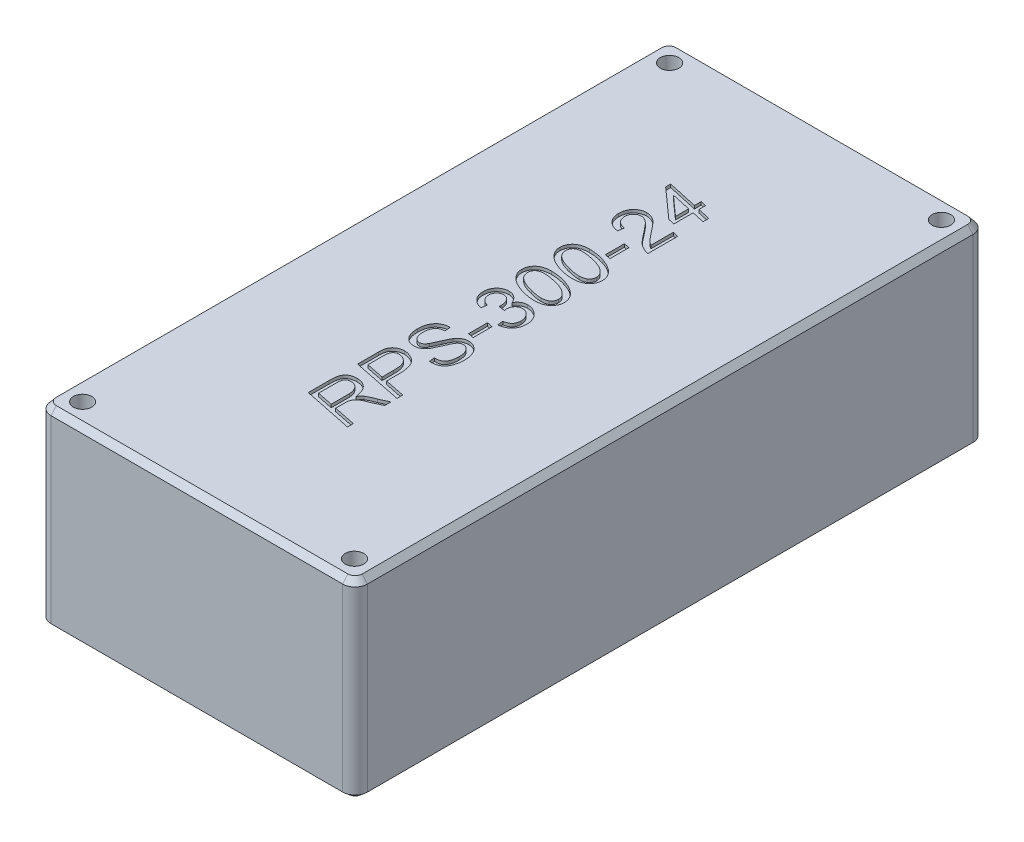
from build123d import *
from OCP.BRepFilletAPI import BRepFilletAPI_MakeChamfer

# Parameters (mm, degrees)
SKETCH_1_W          = 51.2
SKETCH_1_H          = 102
SKETCH_1_R          = 1.5
EXTRUDE_1_DEPTH     = 31
CUT_EXTRUDE_START   = 31
CUT_EXTRUDE_1_DEPTH = 0.5
FILLET_1_R          = 2
CHAMFER_1_SIZE      = 1
CHAMFER_1_SIZE2     = 0.839099631


with BuildPart() as part:
    # Эскиз1 → Бобышка-Вытянуть1 (new body)
    with BuildSketch(Plane(origin=(0, 0, 0), x_dir=(1, 0, 0), z_dir=(0, 1, 0))):
        Rectangle(SKETCH_1_W, SKETCH_1_H)
        with Locations(Location((-22, 47.5, 0), (0, 0, 270))):
            Circle(SKETCH_1_R, mode=Mode.SUBTRACT)
        with Locations(Location((22, 47.5, 0), (0, 0, 270))):
            Circle(SKETCH_1_R, mode=Mode.SUBTRACT)
        with Locations(Location((-22, -47.5, 0), (0, 0, 270))):
            Circle(SKETCH_1_R, mode=Mode.SUBTRACT)
        with Locations(Location((22, -47.5, 0), (0, 0, 270))):
            Circle(SKETCH_1_R, mode=Mode.SUBTRACT)
    extrude(amount=EXTRUDE_1_DEPTH)

    # Эскиз2 → Вырез-Вытянуть1 (cut)
    # profile 1 of 10: a face of its own
    with BuildSketch(Plane(origin=(9.711469616, 0, 7.490347416), x_dir=(0, 0, -1), z_dir=(0, 1, 0)).offset(CUT_EXTRUDE_START)):
        with BuildLine():
            Line((-22.096144557, 6.742030716), (-20.455118916, 14.742030716))
            Line((-20.455118916, 14.742030716), (-17.104157378, 14.742030716))
            add(Edge.make_bspline(
                [(-17.104157378, 14.742030716), (-17.024033136, 14.741073401), (-16.8691024, 14.739222306), (-16.643973201, 14.734723594), (-16.434170274, 14.718450691), (-16.238266442, 14.702744319), (-16.057924121, 14.677350469), (-15.891466065, 14.652249895), (-15.741720929, 14.615760069), (-15.562702299, 14.566475878), (-15.358413224, 14.482037587), (-15.139839717, 14.341781631), (-14.95062384, 14.162511994), (-14.790123435, 13.949934393), (-14.660707837, 13.704058611), (-14.570178113, 13.426196087), (-14.515028265, 13.118682325), (-14.509353241, 12.903600539), (-14.506400967, 12.791710204)],
                knots=[0, 0, 0, 0, 1.021591991, 1.975382171, 2.869596121, 3.703787351, 4.480068521, 5.190988995, 5.848428166, 6.443359442, 7.557581638, 8.651303689, 9.735293539, 10.863044018, 12.032780594, 13.26028335, 14.57473838, 16, 16, 16, 16], degree=3))
            add(Edge.make_bspline(
                [(-14.506400967, 12.791710204), (-14.508180182, 12.712026912), (-14.511679045, 12.555328007), (-14.541305785, 12.325219027), (-14.58904692, 12.10522419), (-14.655890127, 11.895252361), (-14.745670923, 11.697636327), (-14.851153581, 11.508146972), (-14.978788924, 11.33094156), (-15.123227701, 11.162087192), (-15.291076304, 11.007841797), (-15.482498159, 10.867393864), (-15.697197209, 10.741091553), (-15.936740333, 10.631028005), (-16.198514416, 10.533032609), (-16.484272, 10.450783911), (-16.79349987, 10.380995087), (-17.008822116, 10.348552859), (-17.120183019, 10.331774306)],
                knots=[0, 0, 0, 0, 0.959383756, 1.886648769, 2.788937229, 3.667871959, 4.534714923, 5.398951626, 6.275481347, 7.16032984, 8.0709063, 9.014104106, 10.014875828, 11.065445977, 12.185151704, 13.378199168, 14.644050423, 16, 16, 16, 16], degree=3))
            add(Edge.make_bspline(
                [(-17.120183019, 10.331774306), (-17.050599575, 10.282451577), (-16.917552051, 10.188143697), (-16.737148124, 10.038726444), (-16.583144584, 9.890183463), (-16.496466684, 9.78553885), (-16.455118916, 9.73562046)],
                knots=[0, 0, 0, 0, 1.141328929, 2.182286196, 3.13289998, 4, 4, 4, 4], degree=3))
            add(Edge.make_bspline(
                [(-16.455118916, 9.73562046), (-16.385358584, 9.61403593), (-16.246266976, 9.371614665), (-16.063310687, 8.996544241), (-15.900033506, 8.615704354), (-15.807440706, 8.356853274), (-15.76120866, 8.227607639)],
                knots=[0, 0, 0, 0, 1.01134494, 2.016469698, 3.009613427, 4, 4, 4, 4], degree=3))
            Line((-15.76120866, 8.227607639), (-15.078516352, 6.742030716))
            Line((-15.078516352, 6.742030716), (-16.084926608, 6.742030716))
            Line((-16.084926608, 6.742030716), (-16.786849685, 8.266069178))
            add(Edge.make_bspline(
                [(-16.786849685, 8.266069178), (-16.835232802, 8.399589386), (-16.929530609, 8.65981782), (-17.088789186, 9.031345439), (-17.255464082, 9.376685689), (-17.381079243, 9.591073442), (-17.442298403, 9.695556357)],
                knots=[0, 0, 0, 0, 1.081563103, 2.107946641, 3.077898582, 4, 4, 4, 4], degree=3))
            add(Edge.make_bspline(
                [(-17.442298403, 9.695556357), (-17.499115738, 9.754138971), (-17.606853512, 9.865224088), (-17.773518376, 10.009565956), (-17.935947673, 10.121264973), (-18.071460572, 10.192803867), (-18.184008514, 10.235062014), (-18.278769085, 10.25959357), (-18.384657628, 10.28195164), (-18.502209031, 10.301425744), (-18.631686778, 10.31547029), (-18.773398803, 10.324421011), (-18.926738243, 10.331413455), (-19.033101289, 10.331651266), (-19.088131737, 10.331774306)],
                knots=[0, 0, 0, 0, 1.598120377, 3.030376753, 4.310245873, 5.452094104, 6.021554155, 6.661189251, 7.36713587, 8.141211616, 8.993958559, 9.916871072, 10.9222242, 12, 12, 12, 12], degree=3))
            Line((-19.088131737, 10.331774306), (-20.42146507, 10.331774306))
            Line((-20.42146507, 10.331774306), (-21.157041993, 6.742030716))
            Line((-21.157041993, 6.742030716), (-22.096144557, 6.742030716))
        make_face()
        with BuildLine():
            Line((-20.232362506, 11.254851229), (-18.665054813, 11.254851229))
            add(Edge.make_bspline(
                [(-18.665054813, 11.254851229), (-18.578516352, 11.254851229), (-18.412918061, 11.254851229), (-18.176272762, 11.254851229), (-17.963131737, 11.254851229), (-17.774029172, 11.254851229), (-17.60896507, 11.254851229), (-17.467405241, 11.254851229), (-17.349349685, 11.254851229), (-17.278302677, 11.254851229), (-17.246785583, 11.254851229)],
                knots=[0, 0, 0, 0, 1.46440678, 2.802259887, 4.004519774, 5.071186441, 6.002259887, 6.797740113, 7.466666667, 8, 8, 8, 8], degree=3))
            add(Edge.make_bspline(
                [(-17.246785583, 11.254851229), (-17.149859175, 11.266115717), (-16.963392168, 11.287786338), (-16.698964682, 11.343812277), (-16.460847067, 11.416301536), (-16.25039301, 11.51028627), (-16.063151444, 11.620972934), (-15.900813024, 11.752559947), (-15.757348072, 11.898254451), (-15.64109195, 12.063452646), (-15.546022212, 12.238417762), (-15.478288682, 12.422975846), (-15.436338145, 12.614068067), (-15.43177493, 12.743955455), (-15.42947789, 12.809338409)],
                knots=[0, 0, 0, 0, 1.325929785, 2.550823495, 3.669386314, 4.703146632, 5.677069501, 6.617269372, 7.536567314, 8.447451244, 9.353924369, 10.236192207, 11.112131162, 12, 12, 12, 12], degree=3))
            add(Edge.make_bspline(
                [(-15.42947789, 12.809338409), (-15.430946263, 12.863476479), (-15.43382357, 12.969561145), (-15.467406122, 13.122117865), (-15.518477537, 13.26490783), (-15.592431821, 13.393489658), (-15.681956013, 13.507500022), (-15.785316289, 13.604475184), (-15.904197816, 13.677836421), (-16.01304244, 13.725055542), (-16.110654068, 13.751277292), (-16.195842979, 13.771602517), (-16.293676834, 13.784201661), (-16.403044368, 13.798018918), (-16.524513765, 13.806375773), (-16.65744654, 13.815598936), (-16.802341133, 13.817485293), (-16.902771696, 13.818450632), (-16.955118916, 13.818953793)],
                knots=[0, 0, 0, 0, 1.231552236, 2.413252045, 3.541589205, 4.675427927, 5.776114033, 6.835648598, 7.885913462, 8.943978734, 9.52582679, 10.1872786, 10.937816351, 11.771229383, 12.699189452, 13.711307509, 14.807069424, 16, 16, 16, 16], degree=3))
            Line((-16.955118916, 13.818953793), (-19.70672148, 13.818953793))
            Line((-19.70672148, 13.818953793), (-20.232362506, 11.254851229))
        make_face(mode=Mode.SUBTRACT)
    # profile 2 of 10: a face of its own
    with BuildSketch(Plane(origin=(9.711469616, 0, 7.490347416), x_dir=(0, 0, -1), z_dir=(0, 1, 0)).offset(CUT_EXTRUDE_START)):
        with BuildLine():
            Line((-14.096144557, 6.742030716), (-12.469541993, 14.742030716))
            Line((-12.469541993, 14.742030716), (-9.121785583, 14.742030716))
            add(Edge.make_bspline(
                [(-9.121785583, 14.742030716), (-9.051789517, 14.741516156), (-8.916001475, 14.740517942), (-8.719403792, 14.730004732), (-8.535771716, 14.717246072), (-8.3660357, 14.693514104), (-8.208734375, 14.668171524), (-8.066245356, 14.632033005), (-7.93676899, 14.59269687), (-7.783054236, 14.530640948), (-7.605047859, 14.433252429), (-7.415143369, 14.277433017), (-7.241064884, 14.090001667), (-7.093680308, 13.86731048), (-6.968292356, 13.623013422), (-6.877817028, 13.358788952), (-6.823959118, 13.079698177), (-6.817413718, 12.888635295), (-6.814093275, 12.791710204)],
                knots=[0, 0, 0, 0, 0.972213442, 1.886034001, 2.73461593, 3.528031695, 4.266112178, 4.946424875, 5.568385486, 6.144379862, 7.247133722, 8.371276825, 9.542347188, 10.7875294, 12.068525623, 13.34747836, 14.654391165, 16, 16, 16, 16], degree=3))
            add(Edge.make_bspline(
                [(-6.814093275, 12.791710204), (-6.816661065, 12.709311711), (-6.821857053, 12.542576317), (-6.861603627, 12.291630333), (-6.928438606, 12.039481445), (-7.01746765, 11.789421701), (-7.124212132, 11.548792848), (-7.248022793, 11.327042705), (-7.383863682, 11.126187175), (-7.535468106, 10.950993327), (-7.692159269, 10.795923044), (-7.850845625, 10.660249123), (-8.011666201, 10.546226179), (-8.173585512, 10.450282359), (-8.339304768, 10.371215884), (-8.509508354, 10.304752684), (-8.684266954, 10.245131489), (-8.804723453, 10.217488093), (-8.865375326, 10.203569178)],
                knots=[0, 0, 0, 0, 1.108226401, 2.242523613, 3.408656374, 4.613347543, 5.810038033, 6.945723126, 8.026127651, 9.0659746, 10.056915813, 10.989982556, 11.871357951, 12.705775869, 13.519003935, 14.338400696, 15.163356799, 16, 16, 16, 16], degree=3))
            add(Edge.make_bspline(
                [(-8.865375326, 10.203569178), (-8.995963318, 10.175796716), (-9.256938325, 10.120294533), (-9.653169322, 10.065803738), (-10.051158619, 10.030475039), (-10.317222804, 10.026213613), (-10.450311224, 10.024081998)],
                knots=[0, 0, 0, 0, 1.002108218, 2.002674186, 3.000914255, 4, 4, 4, 4], degree=3))
            Line((-10.450311224, 10.024081998), (-12.490375326, 10.024081998))
            Line((-12.490375326, 10.024081998), (-13.157041993, 6.742030716))
            Line((-13.157041993, 6.742030716), (-14.096144557, 6.742030716))
        make_face()
        with BuildLine():
            Line((-12.301272762, 10.947158921), (-10.432683019, 10.947158921))
            add(Edge.make_bspline(
                [(-10.432683019, 10.947158921), (-10.345056974, 10.947518904), (-10.175602811, 10.948215049), (-9.930939532, 10.960711004), (-9.70359559, 10.975270821), (-9.495142434, 10.999488842), (-9.303926762, 11.029122203), (-9.132004128, 11.068058774), (-8.976460607, 11.109870736), (-8.796835227, 11.178527164), (-8.59353215, 11.279615272), (-8.377333049, 11.431856626), (-8.186849746, 11.609645507), (-8.028143677, 11.813606975), (-7.897843356, 12.032217393), (-7.806449396, 12.262869595), (-7.746352377, 12.499112259), (-7.740232731, 12.659942039), (-7.737170198, 12.740428152)],
                knots=[0, 0, 0, 0, 1.151155803, 2.226143411, 3.21826883, 4.143729154, 4.982605772, 5.759118673, 6.459057944, 7.096526282, 8.283022298, 9.431864906, 10.558998043, 11.693536865, 12.816641856, 13.890597882, 14.944364791, 16, 16, 16, 16], degree=3))
            add(Edge.make_bspline(
                [(-7.737170198, 12.740428152), (-7.738483945, 12.800451365), (-7.741003686, 12.915574672), (-7.774886168, 13.079216799), (-7.824176846, 13.227029136), (-7.899103602, 13.355541081), (-7.988508753, 13.469391112), (-8.098724576, 13.564883283), (-8.224475279, 13.645321272), (-8.343699425, 13.699133116), (-8.452809883, 13.735341051), (-8.553904989, 13.756941096), (-8.671627482, 13.775646959), (-8.806903977, 13.791531949), (-8.958714271, 13.803888437), (-9.128074516, 13.813910164), (-9.314607239, 13.817971221), (-9.444968789, 13.818617473), (-9.512811224, 13.818953793)],
                knots=[0, 0, 0, 0, 1.201897544, 2.305215139, 3.33889324, 4.31315314, 5.273763113, 6.230420188, 7.223243535, 8.259085597, 8.845332397, 9.526443264, 10.329775667, 11.236264155, 12.257874257, 13.384875313, 14.639043291, 16, 16, 16, 16], degree=3))
            Line((-9.512811224, 13.818953793), (-11.717939429, 13.818953793))
            Line((-11.717939429, 13.818953793), (-12.301272762, 10.947158921))
        make_face(mode=Mode.SUBTRACT)
    # profile 3 of 10: a face of its own
    with BuildSketch(Plane(origin=(9.711469616, 0, 7.490347416), x_dir=(0, 0, -1), z_dir=(0, 1, 0)).offset(CUT_EXTRUDE_START)):
        with BuildLine():
            Line((-6.301272762, 9.30613328), (-5.378195839, 9.408697383))
            Line((-5.378195839, 9.408697383), (-5.389413788, 9.142671742))
            add(Edge.make_bspline(
                [(-5.389413788, 9.142671742), (-5.386565543, 9.070362317), (-5.380926421, 8.927199899), (-5.338293969, 8.717792005), (-5.268034155, 8.518176886), (-5.172937766, 8.3277768), (-5.043509226, 8.15141773), (-4.874102042, 7.998077315), (-4.6703232, 7.864610096), (-4.431434533, 7.755709615), (-4.164305228, 7.668164801), (-3.870906337, 7.606531544), (-3.55381704, 7.569695089), (-3.334495414, 7.564980271), (-3.221144557, 7.562543537)],
                knots=[0, 0, 0, 0, 0.858275681, 1.699264264, 2.525822281, 3.365565876, 4.218149606, 5.107011874, 6.064126396, 7.09998594, 8.215326971, 9.396056326, 10.654217318, 12, 12, 12, 12], degree=3))
            add(Edge.make_bspline(
                [(-3.221144557, 7.562543537), (-3.140441488, 7.563696987), (-2.983601666, 7.565938623), (-2.755577045, 7.585453193), (-2.542379345, 7.61684374), (-2.343994915, 7.661468083), (-2.160935686, 7.719512419), (-1.991047042, 7.787668765), (-1.836694647, 7.870956021), (-1.698891794, 7.967914537), (-1.576443678, 8.071786105), (-1.467443898, 8.178620958), (-1.378150004, 8.291558566), (-1.302562041, 8.406155218), (-1.244461128, 8.525759392), (-1.202615698, 8.648950103), (-1.177562545, 8.776275166), (-1.174576629, 8.862112542), (-1.173067634, 8.905492255)],
                knots=[0, 0, 0, 0, 1.425731279, 2.770792289, 4.04024254, 5.230893421, 6.3592722, 7.430212247, 8.460708778, 9.450459374, 10.401561135, 11.295891975, 12.14200498, 12.940503131, 13.717227411, 14.484314755, 15.234016756, 16, 16, 16, 16], degree=3))
            add(Edge.make_bspline(
                [(-1.173067634, 8.905492255), (-1.176419479, 8.965737371), (-1.18306914, 9.085256522), (-1.238291653, 9.258868601), (-1.323211923, 9.42579406), (-1.404929113, 9.523389306), (-1.447106096, 9.573761486)],
                knots=[0, 0, 0, 0, 0.976847459, 1.937949255, 2.935706458, 4, 4, 4, 4], degree=3))
            add(Edge.make_bspline(
                [(-1.447106096, 9.573761486), (-1.4748971, 9.600543695), (-1.53734007, 9.660720029), (-1.654471653, 9.745626494), (-1.800786231, 9.838268444), (-1.977667762, 9.937085704), (-2.184366042, 10.042131931), (-2.42126638, 10.15449775), (-2.687885005, 10.274183915), (-2.876961965, 10.354058786), (-2.975952249, 10.39587687)],
                knots=[0, 0, 0, 0, 0.53058602, 1.192161577, 1.98540538, 2.9135926, 3.978754358, 5.17558752, 6.521293165, 8, 8, 8, 8], degree=3))
            add(Edge.make_bspline(
                [(-2.975952249, 10.39587687), (-3.053531435, 10.42817928), (-3.202667221, 10.490276418), (-3.415651489, 10.584292535), (-3.611127512, 10.669119664), (-3.785234742, 10.75220028), (-3.941762639, 10.824791184), (-4.077470881, 10.894248556), (-4.195382526, 10.955745427), (-4.265659369, 10.998127288), (-4.298067634, 11.017671742)],
                knots=[0, 0, 0, 0, 1.379339666, 2.651599208, 3.821445283, 4.876640935, 5.817965058, 6.653218182, 7.378929685, 8, 8, 8, 8], degree=3))
            add(Edge.make_bspline(
                [(-4.298067634, 11.017671742), (-4.386091349, 11.075520848), (-4.555266704, 11.18670274), (-4.775891714, 11.379020907), (-4.96762786, 11.571317248), (-5.118495368, 11.778385907), (-5.236304037, 11.995259075), (-5.318371292, 12.226648069), (-5.369925192, 12.472119146), (-5.375403287, 12.641342943), (-5.378195839, 12.727607639)],
                knots=[0, 0, 0, 0, 1.190296613, 2.28766591, 3.304920813, 4.256269293, 5.175634749, 6.087520294, 7.025081087, 8, 8, 8, 8], degree=3))
            add(Edge.make_bspline(
                [(-5.378195839, 12.727607639), (-5.374193865, 12.827280368), (-5.366306263, 13.023728131), (-5.30349416, 13.310834641), (-5.200173776, 13.582397438), (-5.080442866, 13.794144615), (-4.966484646, 13.953158574), (-4.870075416, 14.065905807), (-4.762738323, 14.170086134), (-4.648718375, 14.270190964), (-4.522194653, 14.358933569), (-4.389025331, 14.443910582), (-4.244371006, 14.517810376), (-4.039782738, 14.611184131), (-3.765629335, 14.705405089), (-3.418390968, 14.787185909), (-3.050515433, 14.835866763), (-2.798749193, 14.841639554), (-2.669862506, 14.844594819)],
                knots=[0, 0, 0, 0, 1.238475896, 2.440946701, 3.635078099, 4.839601842, 5.453463916, 6.065850834, 6.681148677, 7.312269075, 7.950065238, 8.600634686, 9.275045789, 9.967691431, 11.396165333, 12.870345012, 14.397835766, 16, 16, 16, 16], degree=3))
            add(Edge.make_bspline(
                [(-2.669862506, 14.844594819), (-2.592370481, 14.84388717), (-2.440949867, 14.842504413), (-2.218539558, 14.825371663), (-2.004934959, 14.800672297), (-1.800648246, 14.763616571), (-1.605067513, 14.717466496), (-1.419552142, 14.659457978), (-1.242319474, 14.592788563), (-1.075945162, 14.513585885), (-0.919199224, 14.427344818), (-0.772391655, 14.334568297), (-0.637805665, 14.233297619), (-0.513975385, 14.125779044), (-0.400786367, 14.011677526), (-0.30001642, 13.889540357), (-0.209659409, 13.761096637), (-0.107224672, 13.583366811), (-0.00270574, 13.359429058), (0.089869674, 13.091021553), (0.150258754, 12.828590424), (0.156980451, 12.65419168), (0.160265699, 12.568953793)],
                knots=[0, 0, 0, 0, 1.143512507, 2.234441106, 3.290654609, 4.316047515, 5.297102877, 6.254749841, 7.183126598, 8.089581974, 8.971812638, 9.822656227, 10.650539834, 11.455310542, 12.241441721, 13.019784509, 13.789735541, 14.55649065, 16.045011508, 17.428866519, 18.743351145, 20, 20, 20, 20], degree=3))
            add(Edge.make_bspline(
                [(0.160265699, 12.568953793), (0.160265699, 12.546517896), (0.160265699, 12.49096234), (0.160265699, 12.435406785), (0.160265699, 12.402287127)],
                knots=[0, 0, 0, 0, 0.807692308, 2, 2, 2, 2], degree=3))
            Line((0.160265699, 12.402287127), (-0.762811224, 12.318953793))
            add(Edge.make_bspline(
                [(-0.762811224, 12.318953793), (-0.763206778, 12.372401882), (-0.763955392, 12.473556134), (-0.775218358, 12.615909635), (-0.792659107, 12.740206492), (-0.813882544, 12.814845724), (-0.82370866, 12.849402511)],
                knots=[0, 0, 0, 0, 1.196373472, 2.264220624, 3.196361544, 4, 4, 4, 4], degree=3))
            add(Edge.make_bspline(
                [(-0.82370866, 12.849402511), (-0.843237021, 12.903374439), (-0.881729628, 13.009759209), (-0.961134921, 13.157526565), (-1.05551191, 13.291781975), (-1.163160111, 13.416045082), (-1.292704861, 13.52546905), (-1.440704912, 13.62594827), (-1.612626998, 13.711718194), (-1.803595302, 13.786068192), (-2.01146207, 13.847219476), (-2.233205115, 13.889072146), (-2.466636929, 13.918159109), (-2.626498684, 13.920380748), (-2.708324044, 13.921517896)],
                knots=[0, 0, 0, 0, 0.88689608, 1.748172411, 2.584840347, 3.421997753, 4.283274084, 5.199961756, 6.182923366, 7.247800225, 8.366915099, 9.5288022, 10.735115532, 12, 12, 12, 12], degree=3))
            add(Edge.make_bspline(
                [(-2.708324044, 13.921517896), (-2.779936991, 13.92019676), (-2.919113511, 13.917629193), (-3.121611197, 13.900402401), (-3.311604784, 13.869649223), (-3.489569865, 13.82846687), (-3.656095798, 13.775722595), (-3.810295382, 13.710128527), (-3.952417796, 13.631993734), (-4.037993317, 13.569344787), (-4.080118916, 13.538505075)],
                knots=[0, 0, 0, 0, 1.185078943, 2.303147281, 3.3596952, 4.367486573, 5.323590023, 6.246379327, 7.136758724, 8, 8, 8, 8], degree=3))
            add(Edge.make_bspline(
                [(-4.080118916, 13.538505075), (-4.11022356, 13.514167159), (-4.169187729, 13.466497934), (-4.244326295, 13.382617473), (-4.311626244, 13.295746057), (-4.361684727, 13.199203929), (-4.405108055, 13.099755542), (-4.433089348, 12.992700006), (-4.451267698, 12.880472752), (-4.453821868, 12.803536213), (-4.455118916, 12.764466614)],
                knots=[0, 0, 0, 0, 1.039030166, 2.035086348, 3.020315512, 3.984274806, 4.949837582, 5.932341348, 6.950010026, 8, 8, 8, 8], degree=3))
            add(Edge.make_bspline(
                [(-4.455118916, 12.764466614), (-4.453370211, 12.717832149), (-4.449938057, 12.626303473), (-4.419781231, 12.492838536), (-4.371556649, 12.366891661), (-4.302728885, 12.246270123), (-4.205891996, 12.131355667), (-4.079301938, 12.020079985), (-3.922763426, 11.909288529), (-3.804635549, 11.84293254), (-3.74197789, 11.807735845)],
                knots=[0, 0, 0, 0, 0.885166844, 1.737301987, 2.585559362, 3.440410528, 4.36313212, 5.426921844, 6.635181999, 8, 8, 8, 8], degree=3))
            add(Edge.make_bspline(
                [(-3.74197789, 11.807735845), (-3.71367185, 11.793302672), (-3.649186178, 11.760421603), (-3.540904463, 11.705551509), (-3.406460424, 11.643837109), (-3.248764796, 11.569086898), (-3.06413154, 11.489396989), (-2.857681095, 11.394485903), (-2.62430312, 11.294727586), (-2.460945024, 11.223446842), (-2.374990711, 11.185940973)],
                knots=[0, 0, 0, 0, 0.507694923, 1.156609942, 1.939357829, 2.871124938, 3.94489054, 5.152129338, 6.501532703, 8, 8, 8, 8], degree=3))
            add(Edge.make_bspline(
                [(-2.374990711, 11.185940973), (-2.305011851, 11.154959061), (-2.170311214, 11.095322719), (-1.976390083, 11.009450019), (-1.800031258, 10.92781391), (-1.640983377, 10.85055493), (-1.498513214, 10.779096758), (-1.373105163, 10.711459102), (-1.264487301, 10.649683182), (-1.198596814, 10.608670103), (-1.168259942, 10.589787127)],
                knots=[0, 0, 0, 0, 1.363402043, 2.62438005, 3.778247165, 4.825290736, 5.77437896, 6.617445503, 7.363453188, 8, 8, 8, 8], degree=3))
            add(Edge.make_bspline(
                [(-1.168259942, 10.589787127), (-1.097540067, 10.541221014), (-0.95879514, 10.445939428), (-0.775839269, 10.27731007), (-0.616645415, 10.09532227), (-0.484526169, 9.89714932), (-0.379570688, 9.684487156), (-0.303548544, 9.457776743), (-0.257453593, 9.216657897), (-0.252513667, 9.050997165), (-0.249990711, 8.966389691)],
                knots=[0, 0, 0, 0, 1.054714124, 2.069237773, 3.052629045, 4.024524991, 4.991873927, 5.962790947, 6.959541516, 8, 8, 8, 8], degree=3))
            add(Edge.make_bspline(
                [(-0.249990711, 8.966389691), (-0.251332204, 8.9129272), (-0.25398224, 8.807315409), (-0.271862689, 8.650190502), (-0.302596372, 8.497127692), (-0.343791098, 8.345958626), (-0.4012093, 8.199649048), (-0.466214534, 8.054201735), (-0.545371117, 7.912878035), (-0.636422085, 7.776152081), (-0.737493001, 7.64384413), (-0.849606717, 7.519670463), (-0.9700507, 7.402441899), (-1.098908875, 7.292270976), (-1.238612448, 7.19157295), (-1.388174824, 7.09921273), (-1.545371783, 7.011864106), (-1.769087532, 6.906980616), (-2.068067741, 6.797934378), (-2.449593986, 6.705336298), (-2.856312064, 6.650607567), (-3.13550456, 6.643245939), (-3.278836865, 6.639466614)],
                knots=[0, 0, 0, 0, 0.753323331, 1.488142895, 2.22477222, 2.951645461, 3.692569589, 4.437003057, 5.195162042, 5.9717794, 6.750145735, 7.539032231, 8.32684067, 9.11716229, 9.925698599, 10.750710093, 11.592951182, 12.45831893, 14.230046657, 16.066640586, 17.980685438, 20, 20, 20, 20], degree=3))
            add(Edge.make_bspline(
                [(-3.278836865, 6.639466614), (-3.387341329, 6.641318628), (-3.599359417, 6.644937469), (-3.909733337, 6.673021827), (-4.20561433, 6.716591305), (-4.485756447, 6.781735592), (-4.752238007, 6.859937491), (-5.000838405, 6.9628378), (-5.236174368, 7.079025857), (-5.455727654, 7.214653772), (-5.655054057, 7.375121913), (-5.828989634, 7.565428679), (-5.975521776, 7.785494259), (-6.093618459, 8.034871502), (-6.186849871, 8.311890376), (-6.253189333, 8.617628752), (-6.293011143, 8.952524976), (-6.298449478, 9.185292937), (-6.301272762, 9.30613328)],
                knots=[0, 0, 0, 0, 1.125067994, 2.198386657, 3.229442192, 4.223907366, 5.179018808, 6.105903256, 7.010179201, 7.898637484, 8.776811776, 9.655143314, 10.561656395, 11.508166035, 12.508477435, 13.586446658, 14.74701564, 16, 16, 16, 16], degree=3))
        make_face()
    # profile 4 of 10: a face of its own
    with BuildSketch(Plane(origin=(9.711469616, 0, 7.490347416), x_dir=(0, 0, -1), z_dir=(0, 1, 0)).offset(CUT_EXTRUDE_START)):
        Polygon((0.57052211, 9.101005075), (0.775650315, 10.024081998), (3.852573392, 10.024081998), (3.647445187, 9.101005075), align=None)
    # profile 5 of 10: a face of its own
    with BuildSketch(Plane(origin=(9.711469616, 0, 7.490347416), x_dir=(0, 0, -1), z_dir=(0, 1, 0)).offset(CUT_EXTRUDE_START)):
        with BuildLine():
            Line((4.365393904, 8.89587687), (5.288470828, 8.998440973))
            add(Edge.make_bspline(
                [(5.288470828, 8.998440973), (5.298222412, 8.9362922), (5.317096145, 8.816006177), (5.359809878, 8.643940304), (5.408589457, 8.484384285), (5.467906066, 8.338690852), (5.534888542, 8.206381568), (5.610958539, 8.088548987), (5.693835019, 7.982929036), (5.788363628, 7.892893515), (5.889525936, 7.814329528), (5.997996284, 7.745590931), (6.115403165, 7.690476707), (6.239188001, 7.64389404), (6.370267541, 7.606061363), (6.509459244, 7.581811773), (6.656098274, 7.564613697), (6.756365589, 7.563244536), (6.807701597, 7.562543537)],
                knots=[0, 0, 0, 0, 1.294426065, 2.505300711, 3.646088348, 4.726332612, 5.739452866, 6.694195637, 7.609559141, 8.49613314, 9.373796622, 10.243362574, 11.133611648, 12.038411762, 12.964348743, 13.937097054, 14.943811342, 16, 16, 16, 16], degree=3))
            add(Edge.make_bspline(
                [(6.807701597, 7.562543537), (6.869723395, 7.564226033), (6.992568434, 7.567558511), (7.173535737, 7.589723891), (7.348031453, 7.629212702), (7.516565179, 7.681026459), (7.677540018, 7.751119893), (7.832744862, 7.834919343), (7.98134726, 7.934164534), (8.121731556, 8.047507815), (8.249371491, 8.170757737), (8.363109143, 8.299159223), (8.457894141, 8.433361906), (8.537908277, 8.570898126), (8.596720015, 8.714858516), (8.640325331, 8.861862231), (8.669432669, 9.013321573), (8.671861624, 9.116363083), (8.673086212, 9.168312768)],
                knots=[0, 0, 0, 0, 1.094666222, 2.168178271, 3.211243268, 4.24892566, 5.275195374, 6.304535234, 7.358325136, 8.424359069, 9.484540223, 10.486752883, 11.446838671, 12.380022527, 13.288739249, 14.183656868, 15.084267561, 16, 16, 16, 16], degree=3))
            add(Edge.make_bspline(
                [(8.673086212, 9.168312768), (8.671709423, 9.213225987), (8.669010566, 9.30126729), (8.652087948, 9.430575121), (8.618854011, 9.553126223), (8.575803652, 9.67022371), (8.521530034, 9.782443274), (8.451559183, 9.886220727), (8.37075034, 9.9852002), (8.278004511, 10.076985139), (8.176543323, 10.162981404), (8.06295761, 10.23364686), (7.944221859, 10.298320574), (7.81427689, 10.346708491), (7.677479917, 10.387610499), (7.531198486, 10.413607997), (7.377650961, 10.432670923), (7.271975986, 10.433774362), (7.217958007, 10.434338409)],
                knots=[0, 0, 0, 0, 0.995499634, 1.951431809, 2.881733097, 3.803104256, 4.713689825, 5.636276914, 6.569961265, 7.540947269, 8.524622692, 9.509721668, 10.499928494, 11.515565199, 12.575756501, 13.659995629, 14.803857697, 16, 16, 16, 16], degree=3))
            add(Edge.make_bspline(
                [(7.217958007, 10.434338409), (7.201839861, 10.432665632), (7.162459206, 10.428578623), (7.094399147, 10.406214155), (7.005429486, 10.375041592), (6.94002071, 10.347179551), (6.903855443, 10.331774306)],
                knots=[0, 0, 0, 0, 0.584983048, 1.429259602, 2.578607939, 4, 4, 4, 4], degree=3))
            Line((6.903855443, 10.331774306), (7.072124674, 11.376646101))
            add(Edge.make_bspline(
                [(7.072124674, 11.376646101), (7.118008549, 11.37103779), (7.20796394, 11.360042691), (7.298568464, 11.358279276), (7.342958007, 11.357415332)],
                knots=[0, 0, 0, 0, 1.020147305, 2, 2, 2, 2], degree=3))
            add(Edge.make_bspline(
                [(7.342958007, 11.357415332), (7.410839357, 11.358686691), (7.542565571, 11.36115381), (7.734242754, 11.379030053), (7.914146447, 11.407756366), (8.082474755, 11.446519668), (8.237691405, 11.500343618), (8.381069801, 11.564377287), (8.513056648, 11.639451416), (8.632086615, 11.726368819), (8.737196309, 11.822179768), (8.82913841, 11.923895421), (8.908866768, 12.029875174), (8.972927137, 12.141841744), (9.022084194, 12.259890146), (9.056203321, 12.382686235), (9.080796783, 12.510829802), (9.082484142, 12.59821341), (9.083342622, 12.642671742)],
                knots=[0, 0, 0, 0, 1.344989644, 2.610001018, 3.810758888, 4.953276435, 6.027819718, 7.060679099, 8.061136458, 9.030825869, 9.974989578, 10.874297366, 11.744412807, 12.59782058, 13.423467791, 14.271145057, 15.120407015, 16, 16, 16, 16], degree=3))
            add(Edge.make_bspline(
                [(9.083342622, 12.642671742), (9.081797483, 12.683293539), (9.078756407, 12.763243601), (9.064038446, 12.881503191), (9.031706662, 12.993446036), (8.99329209, 13.102083624), (8.937939784, 13.202997656), (8.877108452, 13.30266591), (8.7977284, 13.392656767), (8.712884235, 13.481430426), (8.617364116, 13.559575382), (8.517223096, 13.630814555), (8.409562372, 13.686818132), (8.298346608, 13.736656893), (8.181238071, 13.772240868), (8.059374598, 13.800648154), (7.932056057, 13.816475854), (7.845134677, 13.81812298), (7.80129134, 13.818953793)],
                knots=[0, 0, 0, 0, 1.006415868, 1.980784109, 2.939958003, 3.885636602, 4.8261232, 5.783563509, 6.768996359, 7.788275121, 8.82110339, 9.818881085, 10.82468861, 11.81965813, 12.831791823, 13.848751795, 14.91490564, 16, 16, 16, 16], degree=3))
            add(Edge.make_bspline(
                [(7.80129134, 13.818953793), (7.715439716, 13.814465469), (7.545573259, 13.805584847), (7.297780646, 13.73965977), (7.065082122, 13.627464209), (6.88524583, 13.501498337), (6.751998884, 13.382141202), (6.661510055, 13.28108892), (6.579316362, 13.172132876), (6.507410102, 13.053201297), (6.444859728, 12.925334691), (6.389606022, 12.78925768), (6.347178086, 12.642822962), (6.325268642, 12.541847275), (6.314111853, 12.490428152)],
                knots=[0, 0, 0, 0, 1.422179699, 2.813931943, 4.216039858, 5.685001299, 6.437293795, 7.177079614, 7.929736807, 8.696635281, 9.476761924, 10.287398529, 11.127904274, 12, 12, 12, 12], degree=3))
            Line((6.314111853, 12.490428152), (5.39103493, 12.666710204))
            add(Edge.make_bspline(
                [(5.39103493, 12.666710204), (5.411857909, 12.747151909), (5.452796043, 12.905300911), (5.531378862, 13.132483293), (5.62296725, 13.345972441), (5.728775123, 13.544730834), (5.847967435, 13.73043164), (5.980441533, 13.902030211), (6.127909465, 14.058173838), (6.285891149, 14.201118683), (6.456082032, 14.327295468), (6.634539333, 14.438272762), (6.820029665, 14.533500945), (7.01472424, 14.609073764), (7.21644038, 14.667993995), (7.425317434, 14.711518697), (7.641950518, 14.738012392), (7.788929275, 14.740674699), (7.86379134, 14.742030716)],
                knots=[0, 0, 0, 0, 1.136443385, 2.234256325, 3.285037852, 4.311625962, 5.311034584, 6.30069605, 7.27271469, 8.24561209, 9.211761114, 10.16692971, 11.118035708, 12.059887177, 13.019602162, 13.98994346, 14.976199094, 16, 16, 16, 16], degree=3))
            add(Edge.make_bspline(
                [(7.86379134, 14.742030716), (7.941872953, 14.74019376), (8.094252906, 14.736608854), (8.317219502, 14.708298462), (8.529038031, 14.66472665), (8.729746976, 14.599699817), (8.918899013, 14.516680893), (9.096400845, 14.414719122), (9.262942685, 14.295671296), (9.41528916, 14.157908746), (9.553986749, 14.008545047), (9.675906768, 13.849180159), (9.77564706, 13.679578161), (9.863219484, 13.504720951), (9.926336681, 13.318356221), (9.973041147, 13.12480574), (10.000754886, 12.922311962), (10.004507085, 12.784850144), (10.006419546, 12.714787127)],
                knots=[0, 0, 0, 0, 1.134259844, 2.213561646, 3.260990176, 4.272362256, 5.273314332, 6.257297574, 7.241770573, 8.242240959, 9.236458438, 10.200553682, 11.151053482, 12.091868356, 13.036996352, 14.002839956, 14.982065995, 16, 16, 16, 16], degree=3))
            add(Edge.make_bspline(
                [(10.006419546, 12.714787127), (10.005656882, 12.663461417), (10.004159385, 12.562682997), (9.987502294, 12.413709936), (9.960341343, 12.270236463), (9.923386409, 12.130769432), (9.875438593, 11.996855244), (9.817031315, 11.867195876), (9.748749853, 11.742274132), (9.639910378, 11.583045691), (9.479921205, 11.393706536), (9.246934023, 11.191365484), (8.976198405, 11.007353617), (8.775345898, 10.906409249), (8.671483648, 10.854210204)],
                knots=[0, 0, 0, 0, 0.759331649, 1.490953459, 2.215061569, 2.918859442, 3.624032484, 4.317587384, 5.021740396, 5.727799223, 7.169288722, 8.676073159, 10.281173947, 12, 12, 12, 12], degree=3))
            add(Edge.make_bspline(
                [(8.671483648, 10.854210204), (8.745409941, 10.807381937), (8.888869294, 10.716508276), (9.077738993, 10.554015005), (9.238422604, 10.378557886), (9.369670073, 10.187705045), (9.471785203, 9.982143241), (9.543645015, 9.76245419), (9.588546341, 9.528574827), (9.593580943, 9.367773301), (9.596163135, 9.285299947)],
                knots=[0, 0, 0, 0, 1.096656509, 2.128141768, 3.114964923, 4.074161556, 5.024254478, 5.984293579, 6.966166105, 8, 8, 8, 8], degree=3))
            add(Edge.make_bspline(
                [(9.596163135, 9.285299947), (9.593580204, 9.197574403), (9.588470031, 9.024014705), (9.551281729, 8.767522925), (9.487012973, 8.520584397), (9.397180548, 8.282760139), (9.286261281, 8.052398774), (9.144180269, 7.834021596), (8.980088177, 7.622868793), (8.792925508, 7.423210866), (8.587968914, 7.241161342), (8.372748522, 7.078570206), (8.145382942, 6.943894785), (7.908769756, 6.832714492), (7.662111762, 6.744936696), (7.40504668, 6.685249575), (7.138452706, 6.646764515), (6.957409374, 6.641925863), (6.865393904, 6.639466614)],
                knots=[0, 0, 0, 0, 0.998055054, 1.974591724, 2.941737852, 3.895767833, 4.863544104, 5.844892956, 6.854084383, 7.903391663, 8.953860285, 9.970184025, 10.967813259, 11.954887047, 12.941118261, 13.940726939, 14.953372227, 16, 16, 16, 16], degree=3))
            add(Edge.make_bspline(
                [(6.865393904, 6.639466614), (6.777173039, 6.641252255), (6.60398373, 6.644757708), (6.35093917, 6.674014241), (6.110630554, 6.721783866), (5.883635585, 6.789224576), (5.66961884, 6.875423442), (5.469297253, 6.982640554), (5.281166694, 7.107231272), (5.108279703, 7.251932747), (4.951309514, 7.412176942), (4.811214314, 7.586063787), (4.688705633, 7.772495532), (4.585666423, 7.972339643), (4.50256576, 8.185299758), (4.436549586, 8.410371299), (4.389898479, 8.648653816), (4.373671394, 8.812366497), (4.365393904, 8.89587687)],
                knots=[0, 0, 0, 0, 1.128477531, 2.215351698, 3.254164792, 4.259708192, 5.24079703, 6.200877374, 7.161954649, 8.122813174, 9.079774467, 10.027637401, 10.975475694, 11.929209782, 12.898876159, 13.895928692, 14.926706347, 16, 16, 16, 16], degree=3))
        make_face()
    # profile 6 of 10: a face of its own
    with BuildSketch(Plane(origin=(9.711469616, 0, 7.490347416), x_dir=(0, 0, -1), z_dir=(0, 1, 0)).offset(CUT_EXTRUDE_START)):
        with BuildLine():
            add(Edge.make_bspline(
                [(10.724368263, 9.378248665), (10.728262409, 9.546665431), (10.73610866, 9.886005653), (10.794318482, 10.396476119), (10.888824484, 10.911126012), (11.000165357, 11.337338619), (11.10167707, 11.673194411), (11.182854335, 11.912923898), (11.261284402, 12.141771971), (11.347212017, 12.355100793), (11.431803075, 12.557174212), (11.519510116, 12.745332681), (11.609396268, 12.920636859), (11.729337575, 13.133073339), (11.883577792, 13.374414483), (12.073017032, 13.637466275), (12.26896537, 13.864119501), (12.467703157, 14.05826184), (12.667137502, 14.223402652), (12.864077065, 14.365058503), (13.05941138, 14.48351032), (13.25513936, 14.579967185), (13.45663087, 14.653227437), (13.666839953, 14.703815372), (13.886734743, 14.737631789), (14.037272925, 14.740548271), (14.11379134, 14.742030716)],
                knots=[0, 0, 0, 0, 1.747101877, 3.520207359, 5.323647731, 7.17198113, 8.087188299, 8.963508402, 9.797882957, 10.596537081, 11.34903025, 12.070577558, 12.749756733, 13.392524237, 14.601020179, 15.719556203, 16.75294533, 17.705340404, 18.598757237, 19.436970128, 20.220186583, 20.96628451, 21.697389713, 22.439400533, 23.206748769, 24, 24, 24, 24], degree=3))
            add(Edge.make_bspline(
                [(14.11379134, 14.742030716), (14.188661247, 14.739613799), (14.336347692, 14.734846249), (14.553194673, 14.704983423), (14.760159037, 14.650833254), (14.958318632, 14.578222779), (15.14491486, 14.479673896), (15.324569111, 14.364704635), (15.492801843, 14.225359322), (15.65133813, 14.067234368), (15.796334414, 13.889408712), (15.921676239, 13.690685101), (16.027702892, 13.472941793), (16.113789025, 13.236466797), (16.181165004, 12.981669229), (16.228483475, 12.708220547), (16.257690514, 12.416278049), (16.261085985, 12.215392254), (16.262829802, 12.112223024)],
                knots=[0, 0, 0, 0, 0.939917314, 1.854056634, 2.740402374, 3.620946294, 4.496651673, 5.383808667, 6.293881237, 7.232673747, 8.190877629, 9.16748606, 10.175092672, 11.225176407, 12.321408859, 13.478926332, 14.705248279, 16, 16, 16, 16], degree=3))
            add(Edge.make_bspline(
                [(16.262829802, 12.112223024), (16.261792557, 12.002674362), (16.25972123, 11.783911085), (16.236874057, 11.456351883), (16.20609723, 11.128986522), (16.159410901, 10.802273798), (16.098187788, 10.476827874), (16.024049021, 10.152447317), (15.938318368, 9.828760022), (15.870538712, 9.615170042), (15.836547751, 9.508056357)],
                knots=[0, 0, 0, 0, 0.991953791, 1.98088282, 2.972541631, 3.969391082, 4.96853883, 5.970808941, 6.982376747, 8, 8, 8, 8], degree=3))
            add(Edge.make_bspline(
                [(15.836547751, 9.508056357), (15.794196688, 9.384118645), (15.711575669, 9.142333449), (15.565982316, 8.796536782), (15.409387392, 8.474372031), (15.241453321, 8.174955059), (15.059728628, 7.899762196), (14.866343217, 7.648175265), (14.660796292, 7.419390362), (14.511362033, 7.284605191), (14.437509289, 7.217992255)],
                knots=[0, 0, 0, 0, 1.156851386, 2.256855744, 3.312217261, 4.320255342, 5.287576927, 6.22305918, 7.121808095, 8, 8, 8, 8], degree=3))
            add(Edge.make_bspline(
                [(14.437509289, 7.217992255), (14.380121339, 7.171450734), (14.266879795, 7.079612053), (14.084112829, 6.962892933), (13.896135997, 6.862874367), (13.702158931, 6.780760574), (13.501857003, 6.718033953), (13.295926027, 6.673270605), (13.083579089, 6.645177428), (12.939732476, 6.641384505), (12.866996469, 6.639466614)],
                knots=[0, 0, 0, 0, 1.036639402, 2.045562622, 3.038612224, 4.023386386, 4.998258455, 5.980917096, 6.979051181, 8, 8, 8, 8], degree=3))
            add(Edge.make_bspline(
                [(12.866996469, 6.639466614), (12.793163826, 6.641679924), (12.647994335, 6.646031727), (12.434548797, 6.678752232), (12.229749567, 6.733383244), (12.033276334, 6.810424601), (11.846718814, 6.910800279), (11.668725642, 7.031988978), (11.500674766, 7.175963536), (11.339676332, 7.338671832), (11.19383584, 7.523955607), (11.069134183, 7.731551877), (10.960207437, 7.956721636), (10.875454081, 8.203681074), (10.805302877, 8.469052182), (10.758963267, 8.755130073), (10.729414095, 9.060314459), (10.726081974, 9.270268979), (10.724368263, 9.378248665)],
                knots=[0, 0, 0, 0, 0.906766533, 1.782881265, 2.645647397, 3.505989286, 4.369129693, 5.242807931, 6.14607705, 7.08345785, 8.050973947, 9.034623964, 10.053139792, 11.117877381, 12.236827661, 13.421397294, 14.673823698, 16, 16, 16, 16], degree=3))
        make_face()
        with BuildLine():
            add(Edge.make_bspline(
                [(11.647445187, 9.198761486), (11.647706572, 9.142102693), (11.648215292, 9.03183098), (11.662339485, 8.871494002), (11.680499973, 8.720427636), (11.708138032, 8.578637784), (11.742293653, 8.445940053), (11.787022795, 8.323474316), (11.834441623, 8.208588191), (11.876774589, 8.139531962), (11.897445187, 8.105812768)],
                knots=[0, 0, 0, 0, 1.196860915, 2.329380819, 3.399171222, 4.41098226, 5.380336795, 6.290845662, 7.165443753, 8, 8, 8, 8], degree=3))
            add(Edge.make_bspline(
                [(11.897445187, 8.105812768), (11.926360467, 8.062854918), (11.98297518, 7.978745535), (12.083693649, 7.867236648), (12.193861727, 7.771707788), (12.316194889, 7.69600653), (12.447467063, 7.635851784), (12.589125864, 7.592768705), (12.741546703, 7.566399023), (12.846587214, 7.563853624), (12.900650315, 7.562543537)],
                knots=[0, 0, 0, 0, 1.03779232, 2.031946932, 3.004906514, 3.953478464, 4.907844747, 5.894344765, 6.916244315, 8, 8, 8, 8], degree=3))
            add(Edge.make_bspline(
                [(12.900650315, 7.562543537), (12.948814291, 7.564168727), (13.044063138, 7.567382695), (13.185487375, 7.590621416), (13.323697478, 7.629040433), (13.458333138, 7.683938475), (13.589761615, 7.753915187), (13.717387898, 7.838793432), (13.84227171, 7.939248207), (13.91997861, 8.015376207), (13.959945187, 8.054530716)],
                knots=[0, 0, 0, 0, 0.962272929, 1.902986292, 2.856155992, 3.823567064, 4.802571323, 5.827026166, 6.882385931, 8, 8, 8, 8], degree=3))
            add(Edge.make_bspline(
                [(13.959945187, 8.054530716), (14.016635941, 8.114993781), (14.131755825, 8.237773959), (14.286166679, 8.443644798), (14.433590876, 8.666907644), (14.566559776, 8.912256362), (14.690942618, 9.17702459), (14.80390988, 9.461871596), (14.906613173, 9.766790054), (14.995027442, 10.086437067), (15.075239238, 10.407827793), (15.145752243, 10.719880293), (15.205728958, 11.016873304), (15.253041535, 11.29816925), (15.292871872, 11.564050402), (15.319793479, 11.814789909), (15.337022982, 12.05054612), (15.338865169, 12.202473923), (15.339752879, 12.275684562)],
                knots=[0, 0, 0, 0, 0.878124846, 1.783176658, 2.724091408, 3.712600328, 4.738683035, 5.824010775, 6.959469678, 8.148157314, 9.339055512, 10.471190402, 11.539675327, 12.550816768, 13.495117247, 14.389474043, 15.223923258, 16, 16, 16, 16], degree=3))
            add(Edge.make_bspline(
                [(15.339752879, 12.275684562), (15.338963348, 12.341414163), (15.337433071, 12.468811831), (15.321970396, 12.652635083), (15.293424069, 12.821895154), (15.260808994, 12.977910871), (15.211075478, 13.118335252), (15.154505913, 13.246007884), (15.085157858, 13.358897271), (15.005915866, 13.457356129), (14.9185831, 13.543222004), (14.823853587, 13.616444092), (14.723457241, 13.680212871), (14.616000287, 13.731808107), (14.500890662, 13.769382357), (14.380088061, 13.799520894), (14.251977773, 13.81442494), (14.164567239, 13.817429045), (14.120201597, 13.818953793)],
                knots=[0, 0, 0, 0, 1.40884149, 2.730628537, 3.948596794, 5.0875133, 6.141278735, 7.135372021, 8.076064337, 8.971995299, 9.838389682, 10.695043858, 11.533755643, 12.383957167, 13.242140537, 14.125321841, 15.048497959, 16, 16, 16, 16], degree=3))
            add(Edge.make_bspline(
                [(14.120201597, 13.818953793), (14.054839837, 13.817101864), (13.924650304, 13.813413137), (13.733743643, 13.77438255), (13.548081504, 13.715187879), (13.369071896, 13.629100247), (13.193738002, 13.515451147), (13.027471553, 13.36464887), (12.86250683, 13.182539112), (12.763493414, 13.042869859), (12.711547751, 12.969594819)],
                knots=[0, 0, 0, 0, 0.910919943, 1.814397931, 2.707825795, 3.624734598, 4.577864895, 5.612912186, 6.74765596, 8, 8, 8, 8], degree=3))
            add(Edge.make_bspline(
                [(12.711547751, 12.969594819), (12.673851041, 12.911871044), (12.595878621, 12.792474354), (12.490912908, 12.59595801), (12.386819305, 12.380879613), (12.287979304, 12.144021956), (12.191734988, 11.888156214), (12.101121795, 11.610684416), (12.01076103, 11.314034407), (11.957065431, 11.107623681), (11.929496469, 11.001646101)],
                knots=[0, 0, 0, 0, 0.777422414, 1.608031754, 2.510979195, 3.472422739, 4.502205755, 5.594172927, 6.764774792, 8, 8, 8, 8], degree=3))
            add(Edge.make_bspline(
                [(11.929496469, 11.001646101), (11.907289069, 10.910907839), (11.864007337, 10.734060966), (11.80600311, 10.475090049), (11.758188382, 10.229143364), (11.717198602, 9.996922582), (11.687355231, 9.77763772), (11.664061257, 9.572548693), (11.650923427, 9.381091765), (11.648576653, 9.258073251), (11.647445187, 9.198761486)],
                knots=[0, 0, 0, 0, 1.225829995, 2.389115644, 3.482034577, 4.513449363, 5.482980782, 6.385583559, 7.221630265, 8, 8, 8, 8], degree=3))
        make_face(mode=Mode.SUBTRACT)
    # profile 7 of 10: a face of its own
    with BuildSketch(Plane(origin=(9.711469616, 0, 7.490347416), x_dir=(0, 0, -1), z_dir=(0, 1, 0)).offset(CUT_EXTRUDE_START)):
        with BuildLine():
            add(Edge.make_bspline(
                [(16.878214417, 9.378248665), (16.882108563, 9.546665431), (16.889954814, 9.886005653), (16.948164636, 10.396476119), (17.042670638, 10.911126012), (17.154011511, 11.337338619), (17.255523224, 11.673194411), (17.336700489, 11.912923898), (17.415130555, 12.141771971), (17.501058171, 12.355100793), (17.585649229, 12.557174212), (17.673356269, 12.745332681), (17.763242422, 12.920636859), (17.883183729, 13.133073339), (18.037423945, 13.374414483), (18.226863186, 13.637466275), (18.422811524, 13.864119501), (18.621549311, 14.05826184), (18.820983656, 14.223402652), (19.017923218, 14.365058503), (19.213257534, 14.48351032), (19.408985514, 14.579967185), (19.610477024, 14.653227437), (19.820686107, 14.703815372), (20.040580896, 14.737631789), (20.191119079, 14.740548271), (20.267637494, 14.742030716)],
                knots=[0, 0, 0, 0, 1.747101877, 3.520207359, 5.323647731, 7.17198113, 8.087188299, 8.963508402, 9.797882957, 10.596537081, 11.34903025, 12.070577558, 12.749756733, 13.392524237, 14.601020179, 15.719556203, 16.75294533, 17.705340404, 18.598757237, 19.436970128, 20.220186583, 20.96628451, 21.697389713, 22.439400533, 23.206748769, 24, 24, 24, 24], degree=3))
            add(Edge.make_bspline(
                [(20.267637494, 14.742030716), (20.342507401, 14.739613799), (20.490193845, 14.734846249), (20.707040827, 14.704983423), (20.914005191, 14.650833254), (21.112164786, 14.578222779), (21.298761014, 14.479673896), (21.478415264, 14.364704635), (21.646647997, 14.225359322), (21.805184284, 14.067234368), (21.950180568, 13.889408712), (22.075522393, 13.690685101), (22.181549046, 13.472941793), (22.267635179, 13.236466797), (22.335011157, 12.981669229), (22.382329629, 12.708220547), (22.411536668, 12.416278049), (22.414932139, 12.215392254), (22.416675956, 12.112223024)],
                knots=[0, 0, 0, 0, 0.939917314, 1.854056634, 2.740402374, 3.620946294, 4.496651673, 5.383808667, 6.293881237, 7.232673747, 8.190877629, 9.16748606, 10.175092672, 11.225176407, 12.321408859, 13.478926332, 14.705248279, 16, 16, 16, 16], degree=3))
            add(Edge.make_bspline(
                [(22.416675956, 12.112223024), (22.415638711, 12.002674362), (22.413567383, 11.783911085), (22.390720211, 11.456351883), (22.359943384, 11.128986522), (22.313257055, 10.802273798), (22.252033942, 10.476827874), (22.177895175, 10.152447317), (22.092164521, 9.828760022), (22.024384865, 9.615170042), (21.990393904, 9.508056357)],
                knots=[0, 0, 0, 0, 0.991953791, 1.98088282, 2.972541631, 3.969391082, 4.96853883, 5.970808941, 6.982376747, 8, 8, 8, 8], degree=3))
            add(Edge.make_bspline(
                [(21.990393904, 9.508056357), (21.948042842, 9.384118645), (21.865421823, 9.142333449), (21.71982847, 8.796536782), (21.563233546, 8.474372031), (21.395299475, 8.174955059), (21.213574782, 7.899762196), (21.02018937, 7.648175265), (20.814642445, 7.419390362), (20.665208187, 7.284605191), (20.591355443, 7.217992255)],
                knots=[0, 0, 0, 0, 1.156851386, 2.256855744, 3.312217261, 4.320255342, 5.287576927, 6.22305918, 7.121808095, 8, 8, 8, 8], degree=3))
            add(Edge.make_bspline(
                [(20.591355443, 7.217992255), (20.533967493, 7.171450734), (20.420725949, 7.079612053), (20.237958983, 6.962892933), (20.049982151, 6.862874367), (19.856005085, 6.780760574), (19.655703157, 6.718033953), (19.449772181, 6.673270605), (19.237425243, 6.645177428), (19.09357863, 6.641384505), (19.020842622, 6.639466614)],
                knots=[0, 0, 0, 0, 1.036639402, 2.045562622, 3.038612224, 4.023386386, 4.998258455, 5.980917096, 6.979051181, 8, 8, 8, 8], degree=3))
            add(Edge.make_bspline(
                [(19.020842622, 6.639466614), (18.94700998, 6.641679924), (18.801840489, 6.646031727), (18.588394951, 6.678752232), (18.383595721, 6.733383244), (18.187122488, 6.810424601), (18.000564968, 6.910800279), (17.822571796, 7.031988978), (17.65452092, 7.175963536), (17.493522486, 7.338671832), (17.347681994, 7.523955607), (17.222980337, 7.731551877), (17.114053591, 7.956721636), (17.029300235, 8.203681074), (16.959149031, 8.469052182), (16.912809421, 8.755130073), (16.883260249, 9.060314459), (16.879928128, 9.270268979), (16.878214417, 9.378248665)],
                knots=[0, 0, 0, 0, 0.906766533, 1.782881265, 2.645647397, 3.505989286, 4.369129693, 5.242807931, 6.14607705, 7.08345785, 8.050973947, 9.034623964, 10.053139792, 11.117877381, 12.236827661, 13.421397294, 14.673823698, 16, 16, 16, 16], degree=3))
        make_face()
        with BuildLine():
            add(Edge.make_bspline(
                [(17.80129134, 9.198761486), (17.801552726, 9.142102693), (17.802061446, 9.03183098), (17.816185639, 8.871494002), (17.834346127, 8.720427636), (17.861984186, 8.578637784), (17.896139807, 8.445940053), (17.940868949, 8.323474316), (17.988287777, 8.208588191), (18.030620743, 8.139531962), (18.05129134, 8.105812768)],
                knots=[0, 0, 0, 0, 1.196860915, 2.329380819, 3.399171222, 4.41098226, 5.380336795, 6.290845662, 7.165443753, 8, 8, 8, 8], degree=3))
            add(Edge.make_bspline(
                [(18.05129134, 8.105812768), (18.080206621, 8.062854918), (18.136821334, 7.978745535), (18.237539803, 7.867236648), (18.34770788, 7.771707788), (18.470041043, 7.69600653), (18.601313217, 7.635851784), (18.742972017, 7.592768705), (18.895392857, 7.566399023), (19.000433368, 7.563853624), (19.054496469, 7.562543537)],
                knots=[0, 0, 0, 0, 1.03779232, 2.031946932, 3.004906514, 3.953478464, 4.907844747, 5.894344765, 6.916244315, 8, 8, 8, 8], degree=3))
            add(Edge.make_bspline(
                [(19.054496469, 7.562543537), (19.102660445, 7.564168727), (19.197909292, 7.567382695), (19.339333529, 7.590621416), (19.477543632, 7.629040433), (19.612179292, 7.683938475), (19.743607769, 7.753915187), (19.871234052, 7.838793432), (19.996117863, 7.939248207), (20.073824764, 8.015376207), (20.11379134, 8.054530716)],
                knots=[0, 0, 0, 0, 0.962272929, 1.902986292, 2.856155992, 3.823567064, 4.802571323, 5.827026166, 6.882385931, 8, 8, 8, 8], degree=3))
            add(Edge.make_bspline(
                [(20.11379134, 8.054530716), (20.170482095, 8.114993781), (20.285601978, 8.237773959), (20.440012833, 8.443644798), (20.587437029, 8.666907644), (20.720405929, 8.912256362), (20.844788772, 9.17702459), (20.957756034, 9.461871596), (21.060459326, 9.766790054), (21.148873596, 10.086437067), (21.229085391, 10.407827793), (21.299598397, 10.719880293), (21.359575112, 11.016873304), (21.406887689, 11.29816925), (21.446718026, 11.564050402), (21.473639632, 11.814789909), (21.490869136, 12.05054612), (21.492711323, 12.202473923), (21.493599033, 12.275684562)],
                knots=[0, 0, 0, 0, 0.878124846, 1.783176658, 2.724091408, 3.712600328, 4.738683035, 5.824010775, 6.959469678, 8.148157314, 9.339055512, 10.471190402, 11.539675327, 12.550816768, 13.495117247, 14.389474043, 15.223923258, 16, 16, 16, 16], degree=3))
            add(Edge.make_bspline(
                [(21.493599033, 12.275684562), (21.492809501, 12.341414163), (21.491279225, 12.468811831), (21.47581655, 12.652635083), (21.447270223, 12.821895154), (21.414655148, 12.977910871), (21.364921632, 13.118335252), (21.308352067, 13.246007884), (21.239004012, 13.358897271), (21.15976202, 13.457356129), (21.072429254, 13.543222004), (20.977699741, 13.616444092), (20.877303395, 13.680212871), (20.769846441, 13.731808107), (20.654736816, 13.769382357), (20.533934215, 13.799520894), (20.405823927, 13.81442494), (20.318413393, 13.817429045), (20.274047751, 13.818953793)],
                knots=[0, 0, 0, 0, 1.40884149, 2.730628537, 3.948596794, 5.0875133, 6.141278735, 7.135372021, 8.076064337, 8.971995299, 9.838389682, 10.695043858, 11.533755643, 12.383957167, 13.242140537, 14.125321841, 15.048497959, 16, 16, 16, 16], degree=3))
            add(Edge.make_bspline(
                [(20.274047751, 13.818953793), (20.208685991, 13.817101864), (20.078496458, 13.813413137), (19.887589797, 13.77438255), (19.701927658, 13.715187879), (19.52291805, 13.629100247), (19.347584156, 13.515451147), (19.181317707, 13.36464887), (19.016352983, 13.182539112), (18.917339568, 13.042869859), (18.865393904, 12.969594819)],
                knots=[0, 0, 0, 0, 0.910919943, 1.814397931, 2.707825795, 3.624734598, 4.577864895, 5.612912186, 6.74765596, 8, 8, 8, 8], degree=3))
            add(Edge.make_bspline(
                [(18.865393904, 12.969594819), (18.827697195, 12.911871044), (18.749724775, 12.792474354), (18.644759062, 12.59595801), (18.540665459, 12.380879613), (18.441825458, 12.144021956), (18.345581142, 11.888156214), (18.254967949, 11.610684416), (18.164607184, 11.314034407), (18.110911585, 11.107623681), (18.083342622, 11.001646101)],
                knots=[0, 0, 0, 0, 0.777422414, 1.608031754, 2.510979195, 3.472422739, 4.502205755, 5.594172927, 6.764774792, 8, 8, 8, 8], degree=3))
            add(Edge.make_bspline(
                [(18.083342622, 11.001646101), (18.061135223, 10.910907839), (18.017853491, 10.734060966), (17.959849264, 10.475090049), (17.912034536, 10.229143364), (17.871044756, 9.996922582), (17.841201385, 9.77763772), (17.817907411, 9.572548693), (17.804769581, 9.381091765), (17.802422807, 9.258073251), (17.80129134, 9.198761486)],
                knots=[0, 0, 0, 0, 1.225829995, 2.389115644, 3.482034577, 4.513449363, 5.482980782, 6.385583559, 7.221630265, 8, 8, 8, 8], degree=3))
        make_face(mode=Mode.SUBTRACT)
    # profile 8 of 10: a face of its own
    with BuildSketch(Plane(origin=(9.711469616, 0, 7.490347416), x_dir=(0, 0, -1), z_dir=(0, 1, 0)).offset(CUT_EXTRUDE_START)):
        Polygon((22.724368263, 9.101005075), (22.929496469, 10.024081998), (26.006419546, 10.024081998), (25.80129134, 9.101005075), align=None)
    # profile 9 of 10: a face of its own
    with BuildSketch(Plane(origin=(9.711469616, 0, 7.490347416), x_dir=(0, 0, -1), z_dir=(0, 1, 0)).offset(CUT_EXTRUDE_START)):
        with BuildLine():
            add(Edge.make_bspline(
                [(26.519240058, 6.742030716), (26.545767953, 6.855770964), (26.596941817, 7.07518257), (26.700038002, 7.38540227), (26.811805496, 7.669112031), (26.943919759, 7.926907938), (27.096347947, 8.165520457), (27.267078254, 8.396322634), (27.460961717, 8.620280472), (27.643964751, 8.802356064), (27.812413791, 8.954871889), (27.965268309, 9.089014614), (28.146126104, 9.23912746), (28.350253941, 9.409819859), (28.583424007, 9.594637715), (28.841417498, 9.79887009), (29.126660654, 10.019372153), (29.325811996, 10.172120495), (29.429496469, 10.251646101)],
                knots=[0, 0, 0, 0, 1.19565409, 2.306486854, 3.344873254, 4.316350809, 5.268106172, 6.242045894, 7.254507221, 8.299116766, 8.883951728, 9.581903945, 10.381939106, 11.29125977, 12.307263143, 13.429251172, 14.661587053, 16, 16, 16, 16], degree=3))
            add(Edge.make_bspline(
                [(29.429496469, 10.251646101), (29.49275167, 10.299438461), (29.614587311, 10.391491173), (29.786599301, 10.528695978), (29.945775551, 10.652239918), (30.087026446, 10.768698566), (30.213779492, 10.874299617), (30.325245219, 10.969528709), (30.421393492, 11.055044449), (30.478284967, 11.110431212), (30.504816981, 11.136261486)],
                knots=[0, 0, 0, 0, 1.365683417, 2.63043846, 3.790271687, 4.836599112, 5.783911908, 6.632332888, 7.362172212, 8, 8, 8, 8], degree=3))
            add(Edge.make_bspline(
                [(30.504816981, 11.136261486), (30.570761646, 11.203487178), (30.698216822, 11.333418272), (30.86128699, 11.539895384), (31.004088682, 11.739209989), (31.074813963, 11.879419258), (31.108983648, 11.947158921)],
                knots=[0, 0, 0, 0, 1.111313991, 2.147902678, 3.105191481, 4, 4, 4, 4], degree=3))
            add(Edge.make_bspline(
                [(31.108983648, 11.947158921), (31.12883438, 11.992679665), (31.168655219, 12.083994899), (31.207773074, 12.22962926), (31.232737287, 12.380583513), (31.235695004, 12.483382233), (31.237188776, 12.535299947)],
                knots=[0, 0, 0, 0, 0.981040082, 1.967979846, 2.973743632, 4, 4, 4, 4], degree=3))
            add(Edge.make_bspline(
                [(31.237188776, 12.535299947), (31.235994318, 12.579175355), (31.233637283, 12.66575507), (31.213789319, 12.793085436), (31.18173386, 12.91558096), (31.136960165, 13.032942976), (31.078430595, 13.144499898), (31.007441253, 13.250781456), (30.923510326, 13.352089262), (30.827851243, 13.447399796), (30.723547923, 13.534685923), (30.611849496, 13.610857174), (30.49460991, 13.67468313), (30.372244398, 13.728641435), (30.242991407, 13.768279863), (30.10786627, 13.797081054), (29.96683113, 13.815026653), (29.870788097, 13.817633133), (29.822124674, 13.818953793)],
                knots=[0, 0, 0, 0, 0.989531075, 1.95265005, 2.899875008, 3.842256367, 4.780311308, 5.736390455, 6.720990953, 7.743732119, 8.779248782, 9.785521916, 10.788831058, 11.787495897, 12.797731461, 13.833177973, 14.902106955, 16, 16, 16, 16], degree=3))
            add(Edge.make_bspline(
                [(29.822124674, 13.818953793), (29.773453943, 13.817678215), (29.677926643, 13.815174605), (29.536998197, 13.796665015), (29.400522422, 13.768489839), (29.26836477, 13.726694132), (29.142019604, 13.671336981), (29.018702238, 13.607077753), (28.900134189, 13.530476876), (28.788209339, 13.43998484), (28.680605102, 13.338377433), (28.581979696, 13.221610042), (28.49154569, 13.089692713), (28.408459331, 12.944678113), (28.33520527, 12.784238985), (28.267338177, 12.610662775), (28.208529467, 12.422017735), (28.176619268, 12.290302381), (28.160265699, 12.222799947)],
                knots=[0, 0, 0, 0, 0.928026718, 1.821462011, 2.70666862, 3.583095713, 4.459345134, 5.33434984, 6.23299809, 7.146311635, 8.075902946, 9.051691302, 10.054963165, 11.122787872, 12.234989188, 13.415596859, 14.675526459, 16, 16, 16, 16], degree=3))
            Line((28.160265699, 12.222799947), (27.237188776, 12.36062046))
            add(Edge.make_bspline(
                [(27.237188776, 12.36062046), (27.250882704, 12.450593305), (27.277720645, 12.626925909), (27.338567597, 12.882234111), (27.417551497, 13.122841926), (27.513286344, 13.348700195), (27.626463442, 13.560522428), (27.755727197, 13.758285378), (27.904542578, 13.939775081), (28.067503922, 14.106776294), (28.245504196, 14.255598791), (28.435393996, 14.386111012), (28.635985016, 14.497023134), (28.846986054, 14.587230097), (29.068344702, 14.656295687), (29.300089723, 14.705548164), (29.542406582, 14.737157941), (29.707708996, 14.740389311), (29.791675956, 14.742030716)],
                knots=[0, 0, 0, 0, 1.133348201, 2.221183941, 3.264917563, 4.284594885, 5.272959215, 6.252977644, 7.222616803, 8.191959083, 9.155574371, 10.10798109, 11.058083623, 12.006109937, 12.961603431, 13.941779987, 14.954507234, 16, 16, 16, 16], degree=3))
            add(Edge.make_bspline(
                [(29.791675956, 14.742030716), (29.90409167, 14.738925341), (30.124957326, 14.732824142), (30.447159568, 14.676417805), (30.753616315, 14.586658144), (31.040708457, 14.460625942), (31.303299417, 14.303239852), (31.534856925, 14.115825718), (31.729581904, 13.896970837), (31.884435625, 13.650860059), (32.008000546, 13.391407931), (32.094268631, 13.122824812), (32.150165262, 12.850645407), (32.156904369, 12.666975105), (32.160265699, 12.57536405)],
                knots=[0, 0, 0, 0, 1.125300128, 2.21090221, 3.265747388, 4.317656621, 5.342764023, 6.323953638, 7.290514818, 8.262806532, 9.227484601, 10.161608683, 11.083047359, 12, 12, 12, 12], degree=3))
            add(Edge.make_bspline(
                [(32.160265699, 12.57536405), (32.158093714, 12.508528158), (32.153734542, 12.37438857), (32.128430932, 12.174010046), (32.082372337, 11.976622901), (32.02157445, 11.78053042), (31.940678917, 11.586866927), (31.842870579, 11.394445702), (31.727038106, 11.204264756), (31.6382, 11.082756549), (31.592958007, 11.02087687)],
                knots=[0, 0, 0, 0, 0.952246721, 1.911158524, 2.871035937, 3.836086957, 4.832312834, 5.85662144, 6.908455809, 8, 8, 8, 8], degree=3))
            add(Edge.make_bspline(
                [(31.592958007, 11.02087687), (31.57655064, 11.00098056), (31.54137126, 10.958320463), (31.481668261, 10.89290628), (31.412087237, 10.819824375), (31.331293415, 10.740808415), (31.238813314, 10.656004159), (31.138414794, 10.562373485), (31.025407253, 10.463384192), (30.903237619, 10.356267606), (30.768960062, 10.243860396), (30.625376524, 10.124068591), (30.471386593, 9.996974729), (30.305677322, 9.864219859), (30.130637017, 9.72336775), (29.943469061, 9.577392264), (29.747116842, 9.423787346), (29.612237455, 9.319425567), (29.54327852, 9.266069178)],
                knots=[0, 0, 0, 0, 0.458053507, 0.982122145, 1.572755623, 2.250499986, 2.989089072, 3.801693331, 4.689040006, 5.657608701, 6.687939627, 7.799657092, 8.979436618, 10.234693057, 11.57145127, 12.970516793, 14.451135189, 16, 16, 16, 16], degree=3))
            add(Edge.make_bspline(
                [(29.54327852, 9.266069178), (29.484445171, 9.220222527), (29.370138053, 9.131147222), (29.204909984, 8.999915498), (29.051865208, 8.874473843), (28.907454032, 8.758607214), (28.779150578, 8.643998684), (28.659857864, 8.538487164), (28.552421488, 8.439689168), (28.428191144, 8.317017331), (28.28957988, 8.171964785), (28.14473854, 7.999131809), (28.019362147, 7.833530532), (27.951022713, 7.719665156), (27.91827852, 7.665107639)],
                knots=[0, 0, 0, 0, 1.170046814, 2.273280081, 3.309796523, 4.274376893, 5.176980181, 6.007885263, 6.772831956, 7.466125581, 8.746499211, 9.918135335, 11.002494255, 12, 12, 12, 12], degree=3))
            Line((27.91827852, 7.665107639), (31.544881084, 7.665107639))
            Line((31.544881084, 7.665107639), (31.350970828, 6.742030716))
            Line((31.350970828, 6.742030716), (26.519240058, 6.742030716))
        make_face()
    # profile 10 of 10: a face of its own
    with BuildSketch(Plane(origin=(9.711469616, 0, 7.490347416), x_dir=(0, 0, -1), z_dir=(0, 1, 0)).offset(CUT_EXTRUDE_START)):
        Polygon((35.442316981, 6.742030716), (35.889432366, 8.793312768), (32.775650315, 8.793312768), (32.98077852, 9.815748665), (37.288470828, 14.639466614), (38.102573392, 14.639466614), (37.030458007, 9.716389691), (38.108983648, 9.716389691), (37.903855443, 8.793312768), (36.830137494, 8.793312768), (36.38302211, 6.742030716), align=None)
        Polygon((36.089752879, 9.716389691), (36.777252879, 12.876646101), (33.955137494, 9.716389691), align=None, mode=Mode.SUBTRACT)
    extrude(amount=-CUT_EXTRUDE_1_DEPTH, mode=Mode.SUBTRACT)

    # Скругление1
    fillet_1_edges = [part.edges().sort_by_distance(p)[0] for p in [
        (25.6, 15.5, 51),
        (-25.6, 15.5, 51),
        (-25.6, 15.5, -51),
        (25.6, 15.5, -51),
    ]]
    fillet(fillet_1_edges, radius=FILLET_1_R)

    # Фаска1: one chamfer whose edges measure the first distance from different faces: ONE call of the kernel's chamfer builder (chamfer() names one face for all edges)
    chamfer_1_edges_1 = [part.edges().sort_by_distance(p)[0] for p in [
        (-25.6, 0, 0),
        (25.6, 0, 0),
        (0, 0, 51),
        (0, 0, -51),
        (-25.014213562, 0, 50.414213562),
        (25.014213562, 0, 50.414213562),
        (25.014213562, 0, -50.414213562),
        (-25.014213562, 0, -50.414213562),
    ]]
    chamfer_1_side_1 = [part.faces().sort_by_distance(p)[0] for p in [
        (0, 0, 0),
    ]]
    chamfer_1_edges_2 = [part.edges().sort_by_distance(p)[0] for p in [
        (-25.6, 31, 0),
    ]]
    chamfer_1_side_2 = [part.faces().sort_by_distance(p)[0] for p in [
        (-25.6, 15.5, 0),
    ]]
    chamfer_1_edges_3 = [part.edges().sort_by_distance(p)[0] for p in [
        (0, 31, -51),
    ]]
    chamfer_1_side_3 = [part.faces().sort_by_distance(p)[0] for p in [
        (0, 15.5, -51),
    ]]
    chamfer_1_edges_4 = [part.edges().sort_by_distance(p)[0] for p in [
        (25.6, 31, 0),
    ]]
    chamfer_1_side_4 = [part.faces().sort_by_distance(p)[0] for p in [
        (25.6, 15.5, 0),
    ]]
    chamfer_1_edges_5 = [part.edges().sort_by_distance(p)[0] for p in [
        (0, 31, 51),
    ]]
    chamfer_1_side_5 = [part.faces().sort_by_distance(p)[0] for p in [
        (0, 15.5, 51),
    ]]
    chamfer_1_edges_6 = [part.edges().sort_by_distance(p)[0] for p in [
        (-25.014213562, 31, 50.414213562),
    ]]
    chamfer_1_side_6 = [part.faces().sort_by_distance(p)[0] for p in [
        (-25.014213562, 15.5, 50.414213562),
    ]]
    chamfer_1_edges_7 = [part.edges().sort_by_distance(p)[0] for p in [
        (25.014213562, 31, 50.414213562),
    ]]
    chamfer_1_side_7 = [part.faces().sort_by_distance(p)[0] for p in [
        (25.014213562, 15.5, 50.414213562),
    ]]
    chamfer_1_edges_8 = [part.edges().sort_by_distance(p)[0] for p in [
        (25.014213562, 31, -50.414213562),
    ]]
    chamfer_1_side_8 = [part.faces().sort_by_distance(p)[0] for p in [
        (25.014213562, 15.5, -50.414213562),
    ]]
    chamfer_1_edges_9 = [part.edges().sort_by_distance(p)[0] for p in [
        (-25.014213562, 31, -50.414213562),
    ]]
    chamfer_1_side_9 = [part.faces().sort_by_distance(p)[0] for p in [
        (-25.014213562, 15.5, -50.414213562),
    ]]
    chamfer_1 = BRepFilletAPI_MakeChamfer(part.part.solid().wrapped)
    for e in chamfer_1_edges_1:
        chamfer_1.Add(CHAMFER_1_SIZE, CHAMFER_1_SIZE2, e.wrapped, chamfer_1_side_1[0].wrapped)  # the first distance lies on this face
    for e in chamfer_1_edges_2:
        chamfer_1.Add(CHAMFER_1_SIZE, CHAMFER_1_SIZE2, e.wrapped, chamfer_1_side_2[0].wrapped)  # the first distance lies on this face
    for e in chamfer_1_edges_3:
        chamfer_1.Add(CHAMFER_1_SIZE, CHAMFER_1_SIZE2, e.wrapped, chamfer_1_side_3[0].wrapped)  # the first distance lies on this face
    for e in chamfer_1_edges_4:
        chamfer_1.Add(CHAMFER_1_SIZE, CHAMFER_1_SIZE2, e.wrapped, chamfer_1_side_4[0].wrapped)  # the first distance lies on this face
    for e in chamfer_1_edges_5:
        chamfer_1.Add(CHAMFER_1_SIZE, CHAMFER_1_SIZE2, e.wrapped, chamfer_1_side_5[0].wrapped)  # the first distance lies on this face
    for e in chamfer_1_edges_6:
        chamfer_1.Add(CHAMFER_1_SIZE, CHAMFER_1_SIZE2, e.wrapped, chamfer_1_side_6[0].wrapped)  # the first distance lies on this face
    for e in chamfer_1_edges_7:
        chamfer_1.Add(CHAMFER_1_SIZE, CHAMFER_1_SIZE2, e.wrapped, chamfer_1_side_7[0].wrapped)  # the first distance lies on this face
    for e in chamfer_1_edges_8:
        chamfer_1.Add(CHAMFER_1_SIZE, CHAMFER_1_SIZE2, e.wrapped, chamfer_1_side_8[0].wrapped)  # the first distance lies on this face
    for e in chamfer_1_edges_9:
        chamfer_1.Add(CHAMFER_1_SIZE, CHAMFER_1_SIZE2, e.wrapped, chamfer_1_side_9[0].wrapped)  # the first distance lies on this face
    add(Compound.cast(chamfer_1.Shape()), mode=Mode.REPLACE)


solid = part.part
